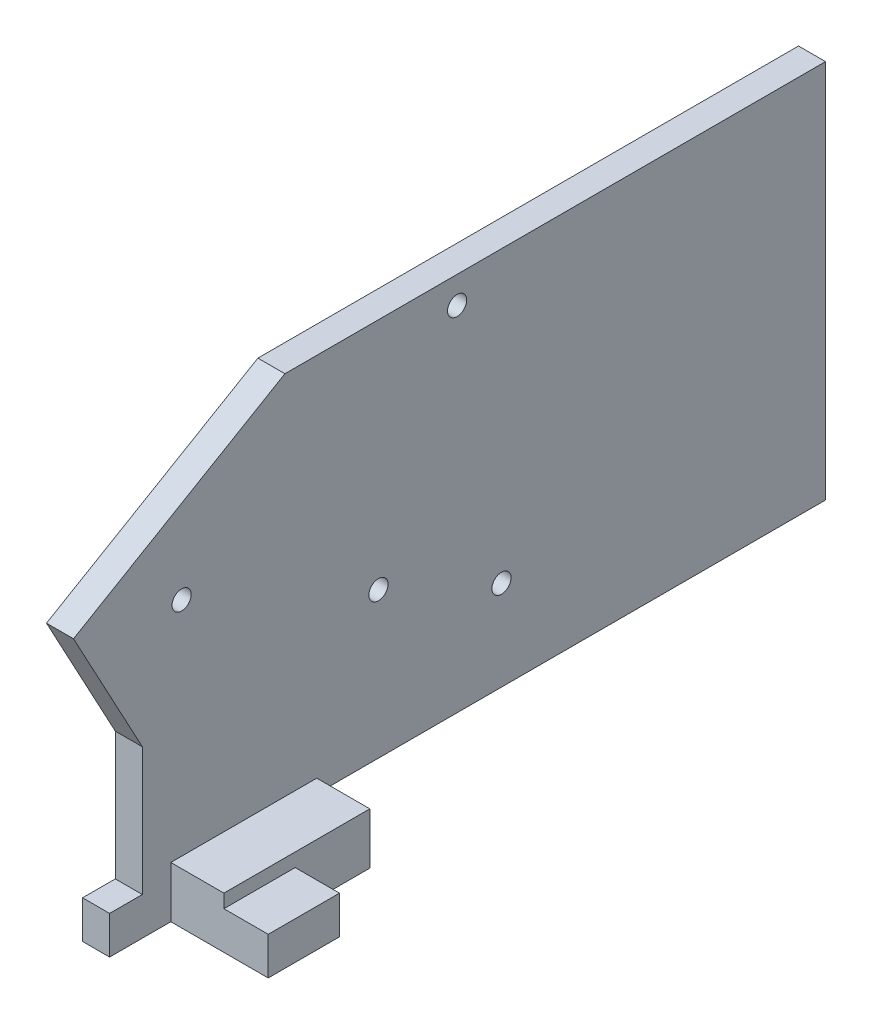
from build123d import *

# Parameters (mm, degrees)
SKETCH2_R           = 2.2479
BOSS_EXTRUDE3_DEPTH = 6.35
SKETCH2_5_W         = 34.29
SKETCH2_5_H         = 12.065
BOSS_EXTRUDE4_DEPTH = 12.4714
SKETCH3_W           = 16.74
SKETCH3_H           = 8.89
BOSS_EXTRUDE5_DEPTH = 10.414


with BuildPart() as part:
    # Sketch2 → Boss-Extrude3 (new body)
    with BuildSketch(Plane(origin=(0, 0, 0), x_dir=(0, 0, -1), z_dir=(1, 0, 0))):
        Polygon((16.17094154, 0), (8.480621378, 0), (8.480621378, -8.89), (57.15, -8.89), (57.15, 0), (176.670010733, 0), (176.670010733, 89.2048), (49.670010733, 89.2048), (0, 60.116195388), (16.17094154, 30.058097694), align=None)
        with Locations((90.119204984, 82.8548)):
            Circle(SKETCH2_R, mode=Mode.SUBTRACT)
        with Locations((71.642065552, 34.29)):
            Circle(SKETCH2_R, mode=Mode.SUBTRACT)
        with Locations((100.543356523, 21.1455)):
            Circle(SKETCH2_R, mode=Mode.SUBTRACT)
        with Locations((25.4, 55.3212)):
            Circle(SKETCH2_R, mode=Mode.SUBTRACT)
    extrude(amount=-BOSS_EXTRUDE3_DEPTH)

    # Sketch2<5> → Boss-Extrude4 (add)
    with BuildSketch(Plane(origin=(0, 0, 0), x_dir=(0, 0, -1), z_dir=(1, 0, 0))):
        with Locations((40.005, -2.8575)):
            Rectangle(SKETCH2_5_W, SKETCH2_5_H)
    extrude(amount=BOSS_EXTRUDE4_DEPTH)

    # Sketch3 → Boss-Extrude5 (add)
    with BuildSketch(Plane(origin=(12.4714, 0, 0), x_dir=(0, 0, -1), z_dir=(1, 0, 0))):
        with Locations((31.23, -4.445)):
            Rectangle(SKETCH3_W, SKETCH3_H)
    extrude(amount=BOSS_EXTRUDE5_DEPTH)


solid = part.part
